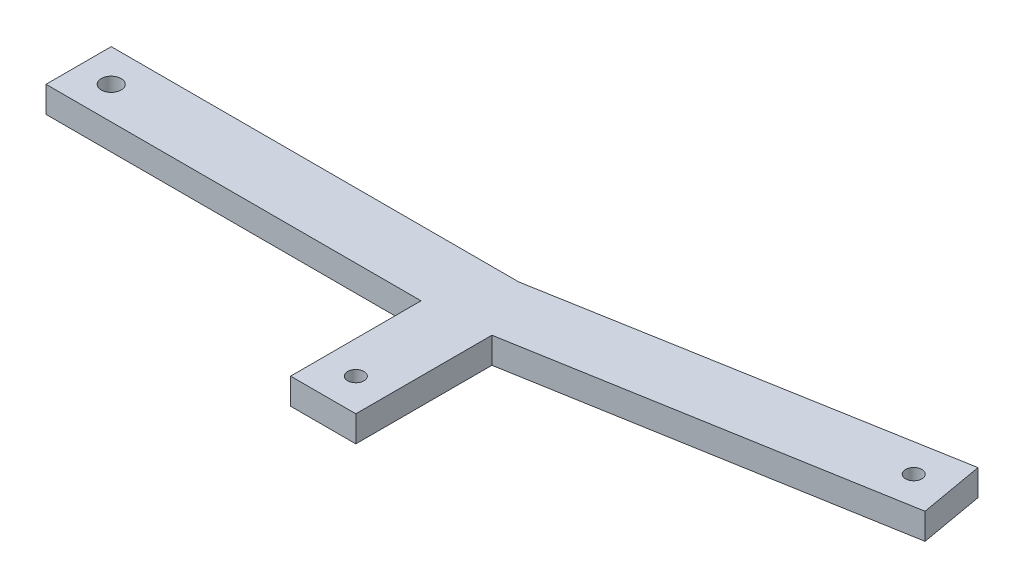
from build123d import *

# Parameters (mm, degrees)
SKETCH1_R           = 3.05
SKETCH1_R_2         = 2.5
BOSS_EXTRUDE1_DEPTH = 8


with BuildPart() as part:
    # Sketch1 → Boss-Extrude1 (new body)
    with BuildSketch(Plane(origin=(0, 0, 0), x_dir=(1, 0, 0), z_dir=(0, 1, 0))):
        Polygon((75.861805451, 10), (195.542164518, 31.102876365), (199.018293649, 11.388768424), (85.861805451, -8.263285294), (85.861805451, -50), (75.861805451, -50), (65.861805451, -50), (65.861805451, -10), (-49.138194549, -10), (-49.138194549, 10), align=None)
        with Locations(Location((-39.138194549, 0, 0), (0, 0, 270))):
            Circle(SKETCH1_R, mode=Mode.SUBTRACT)
        with Locations(Location((75.861805451, -40, 0), (0, 0, 270))):
            Circle(SKETCH1_R_2, mode=Mode.SUBTRACT)
        with Locations(Location((187.432151553, 19.509340618, 0), (0, 0, 270))):
            Circle(SKETCH1_R_2, mode=Mode.SUBTRACT)
    extrude(amount=BOSS_EXTRUDE1_DEPTH)


solid = part.part
